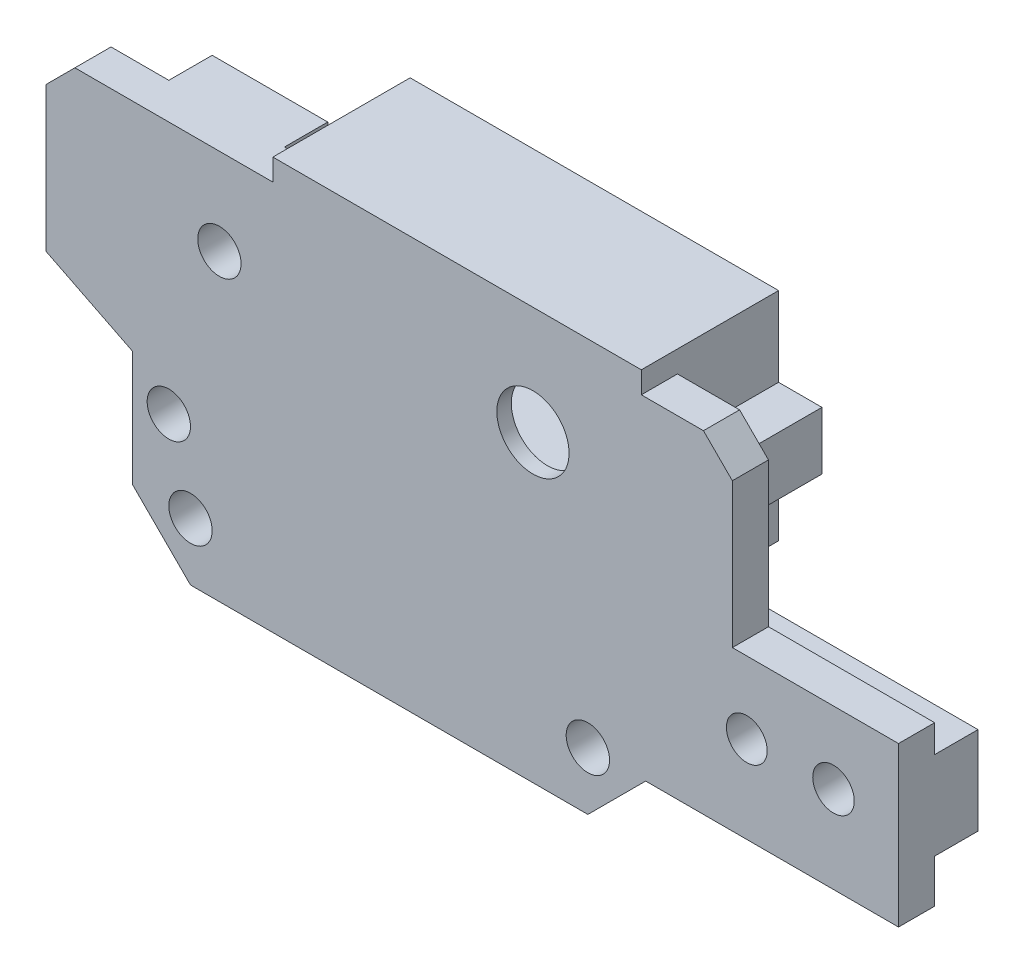
from build123d import *

# Parameters (mm, degrees)
SKETCH_1_R           = 1.5
EXTRUDE_1_DEPTH      = 2.5
EXTRUDE_2_DEPTH      = 7
EXTRUDE_2_DEPTH_BACK = 2.5
SKETCH_2_R           = 1.45
SKETCH_2_W           = 22.5
SKETCH_2_H           = 12
SKETCH_3_W           = 8
SKETCH_3_H           = 20
SKETCH_3_R           = 1.5
EXTRUDE_3_DEPTH      = 3
SKETCH_4_R           = 1.5
CUT_EXTRUDE_1_DEPTH  = 54.969899018
SKETCH_6_R           = 3.49128416
EXTRUDE_4_DEPTH      = 2.5
SKETCH_7_R           = 6
CUT_EXTRUDE_3_DEPTH  = 1.5
CUT_EXTRUDE_4_DEPTH  = 1.5
SKETCH_9_R           = 2.5
CUT_EXTRUDE_5_DEPTH  = 1.5
CUT_EXTRUDE_6_DEPTH  = 55.522930956
CHAMFER_1_SIZE       = 2
SKETCH_11_R          = 1.5
CUT_EXTRUDE_8_DEPTH  = 52.232314022
EXTRUDE_START        = -3
EXTRUDE_7_DEPTH      = 3
SKETCH_18_W          = 3
SKETCH_18_H          = 6.085719459
EXTRUDE_9_DEPTH      = 45
SKETCH_19_R          = 1.410967792
SKETCH_19_R_2        = 1.436695047
CUT_EXTRUDE_9_DEPTH  = 45
EXTRUDE_10_DEPTH     = 17.5
SKETCH_21_R          = 1.436695047
SKETCH_21_R_2        = 1.410967792
CUT_EXTRUDE_10_DEPTH = 17.5


with BuildPart() as part:
    # 草图1 → 凸台-拉伸1 (new body)
    with BuildSketch(Plane.XY):
        Polygon((4, 0), (0, 4), (0, 12), (-10, 17), (-10, 27), (45.5, 27), (45.5, 17), (35.5, 12), (35.5, 4), (31.5, 0), align=None)
        with Locations((4, 4)):
            Circle(SKETCH_1_R, mode=Mode.SUBTRACT)
        with Locations((31.5, 4)):
            Circle(SKETCH_1_R, mode=Mode.SUBTRACT)
        with Locations((7, 21)):
            Circle(SKETCH_1_R, mode=Mode.SUBTRACT)
        with Locations((28.5, 21)):
            Circle(SKETCH_1_R, mode=Mode.SUBTRACT)
    extrude(amount=EXTRUDE_1_DEPTH)

    # 草图2 → 凸台-拉伸2 (add, two sides: drawn at the far end of the back side and taken through both)
    with BuildSketch(Plane(origin=(0, 0, 0), x_dir=(-1, 0, 0), z_dir=(0, 0, -1)).offset(-EXTRUDE_2_DEPTH_BACK)):
        with BuildLine():
            Line((-35.2, 28.5), (-9.7, 28.5))
            Line((-9.7, 28.5), (-9.7, 23))
            Line((-9.7, 23), (-8.2, 23))
            Line((-8.2, 23), (-8.2, 22.240967365))
            ThreePointArc((-8.2, 22.240967365), (-10.4, 21), (-8.2, 19.759032635))
            Line((-8.2, 19.759032635), (-8.2, 19))
            Line((-8.2, 19), (-9.7, 19))
            Line((-9.7, 19), (-9.7, 13.5))
            Line((-9.7, 13.5), (-35.2, 13.5))
            Line((-35.2, 13.5), (-35.2, 19))
            Line((-35.2, 19), (-38.2, 19))
            Line((-38.2, 19), (-38.2, 23))
            Line((-38.2, 23), (-35.2, 23))
            Line((-35.2, 23), (-35.2, 28.5))
        make_face()
        with Locations((-35.95, 21)):
            Circle(SKETCH_2_R, mode=Mode.SUBTRACT)
        with Locations((-22.45, 21)):
            Rectangle(SKETCH_2_W, SKETCH_2_H, mode=Mode.SUBTRACT)
    extrude(amount=EXTRUDE_2_DEPTH + EXTRUDE_2_DEPTH_BACK)

    # 草图3 → 凸台-拉伸3 (add)
    with BuildSketch(Plane(origin=(0, 0, 0), x_dir=(-1, 0, 0), z_dir=(0, 0, -1))):
        with Locations((-4, 17)):
            Rectangle(SKETCH_3_W, SKETCH_3_H)
        with Locations((-2.5, 9.5)):
            Circle(SKETCH_3_R, mode=Mode.SUBTRACT)
        with Locations((-2.5, 18.5)):
            Circle(SKETCH_3_R, mode=Mode.SUBTRACT)
    extrude(amount=EXTRUDE_3_DEPTH)

    # 草图4 → 切除-拉伸1 (cut, through all)
    with BuildSketch(Plane(origin=(0, 0, -3), x_dir=(-1, 0, 0), z_dir=(0, 0, -1))):
        with Locations((-2.5, 9.5)):
            Circle(SKETCH_4_R)
        with Locations(Location((-7, 21, 0), (0, 0, 228.189685104))):
            Circle(SKETCH_4_R)
    extrude(amount=-CUT_EXTRUDE_1_DEPTH, mode=Mode.SUBTRACT)

    # 草图6 → 凸台-拉伸4 (add)
    with BuildSketch(Plane(origin=(0, 0, 0), x_dir=(-1, 0, 0), z_dir=(0, 0, -1))):
        with Locations((-27, 21)):
            Circle(SKETCH_6_R)
    extrude(amount=-EXTRUDE_4_DEPTH)

    # 草图7 → 切除-拉伸3 (cut)
    with BuildSketch(Plane(origin=(0, 0, 0), x_dir=(-1, 0, 0), z_dir=(0, 0, -1))):
        with Locations((-27.7, 21)):
            Circle(SKETCH_7_R)
    extrude(amount=-CUT_EXTRUDE_3_DEPTH, mode=Mode.SUBTRACT)

    # 草图8 → 切除-拉伸4 (cut)
    with BuildSketch(Plane(origin=(0, 0, 0), x_dir=(-1, 0, 0), z_dir=(0, 0, -1))):
        with BuildLine():
            ThreePointArc((-21.71878059, 17.962224138), (-18.800764933, 20.795559838), (-21.585591732, 23.759905678))
            ThreePointArc((-21.585591732, 23.759905678), (-22.24975442, 23.944667862), (-22.761132033, 24.406990344))
            ThreePointArc((-22.761132033, 24.406990344), (-21.701582619, 20.862199682), (-22.92279575, 17.369804474))
            ThreePointArc((-22.92279575, 17.369804474), (-22.39072715, 17.808156096), (-21.71878059, 17.962224138))
        make_face()
    extrude(amount=-CUT_EXTRUDE_4_DEPTH, mode=Mode.SUBTRACT)

    # 草图9 → 切除-拉伸5 (cut)
    with BuildSketch(Plane(origin=(0, 0, 1.5), x_dir=(-1, 0, 0), z_dir=(0, 0, -1))):
        with Locations((-27.7, 21)):
            Circle(SKETCH_9_R)
    extrude(amount=-CUT_EXTRUDE_5_DEPTH, mode=Mode.SUBTRACT)

    # 草图10 → 切除-拉伸6 (cut, through all)
    with BuildSketch(Plane.XY.offset(2.5)):
        Polygon((-6, 27), (-6, 15), (-10, 17), (-10, 27), align=None)
        Polygon((41.5, 27), (41.5, 15), (45.5, 17), (45.5, 27), align=None)
    extrude(amount=-CUT_EXTRUDE_6_DEPTH, mode=Mode.SUBTRACT)

    # 倒角1
    chamfer_1_edges = [part.edges().sort_by_distance(p)[0] for p in [
        (-6, 27, 1.25),
        (41.5, 27, 1.25),
    ]]
    chamfer(chamfer_1_edges, length=CHAMFER_1_SIZE)

    # 草图11 → 切除-拉伸8 (cut, through all)
    with BuildSketch(Plane.XY.offset(2.5)):
        with Locations((6, 21)):
            Circle(SKETCH_11_R)
        with Locations((7, 21)):
            Circle(SKETCH_11_R)
    extrude(amount=-CUT_EXTRUDE_8_DEPTH, mode=Mode.SUBTRACT)

    # 草图12 → 凸台-拉伸7 (add)
    with BuildSketch(Plane.XY.offset(2.5).offset(EXTRUDE_START)):
        with BuildLine():
            ThreePointArc((6.5, 19.585786438), (8.5, 21), (6.5, 22.414213562))
            ThreePointArc((6.5, 22.414213562), (7.5, 21), (6.5, 19.585786438))
        make_face()
    extrude(amount=EXTRUDE_7_DEPTH)

    # 草图18 → 凸台-拉伸9 (add)
    with BuildSketch(Plane(origin=(8, 0, 0), x_dir=(0, 0, -1), z_dir=(1, 0, 0))):
        with Locations((1.5, 10.04285973)):
            Rectangle(SKETCH_18_W, SKETCH_18_H)
    extrude(amount=EXTRUDE_9_DEPTH)

    # 草图19 → 切除-拉伸9 (cut)
    with BuildSketch(Plane(origin=(0, 0, -3), x_dir=(-1, 0, 0), z_dir=(0, 0, -1))):
        with Locations((-42.5, 10.017096625)):
            Circle(SKETCH_19_R)
        with Locations((-48.5, 10.017096625)):
            Circle(SKETCH_19_R_2)
    extrude(amount=-CUT_EXTRUDE_9_DEPTH, mode=Mode.SUBTRACT)

    # 草图20 → 凸台-拉伸10 (add)
    with BuildSketch(Plane(origin=(35.5, 0, 0), x_dir=(0, 0, -1), z_dir=(1, 0, 0))):
        Polygon((-2.5, 15), (-2.5, 12), (-2.5, 4), (0, 4), (0, 7), (0, 12), (0, 15), align=None)
    extrude(amount=EXTRUDE_10_DEPTH)

    # 草图21 → 切除-拉伸10 (cut)
    with BuildSketch(Plane(origin=(0, 0, 0), x_dir=(-1, 0, 0), z_dir=(0, 0, -1))):
        with Locations((-48.5, 10.017096625)):
            Circle(SKETCH_21_R)
        with Locations((-42.5, 10.017096625)):
            Circle(SKETCH_21_R_2)
    extrude(amount=-CUT_EXTRUDE_10_DEPTH, mode=Mode.SUBTRACT)


solid = part.part
